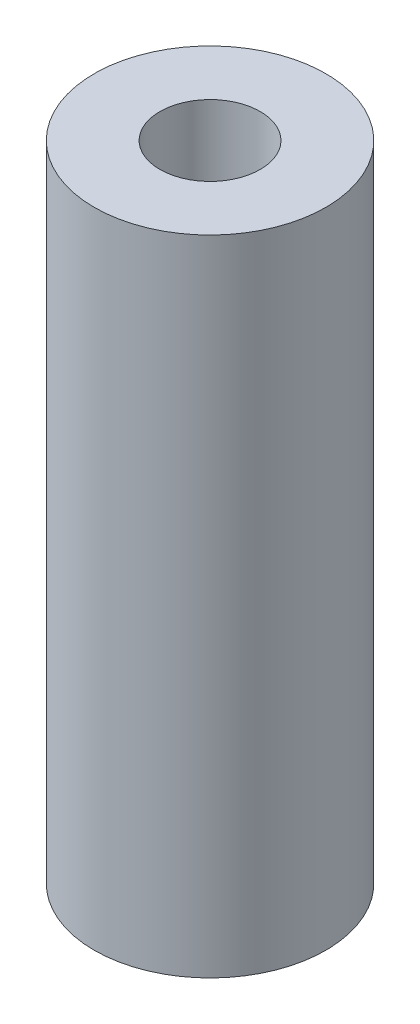
from build123d import *

# Parameters (mm, degrees)
SKETCH1_R           = 4.5
SKETCH1_R_2         = 2.05
BOSS_EXTRUDE1_DEPTH = 10
SKETCH3_R           = 4.5
SKETCH3_R_2         = 1.95
BOSS_EXTRUDE3_DEPTH = 15


with BuildPart() as part:
    # Sketch1 → Boss-Extrude1 (new body)
    with BuildSketch(Plane(origin=(0, 0, 0), x_dir=(1, 0, 0), z_dir=(0, 1, 0))):
        with Locations(Location((0, 0, 0), (0, 0, 270))):
            Circle(SKETCH1_R)
        with Locations(Location((0, 0, 0), (0, 0, 270))):
            Circle(SKETCH1_R_2, mode=Mode.SUBTRACT)
    extrude(amount=BOSS_EXTRUDE1_DEPTH)

    # Sketch3 → Boss-Extrude3 (add)
    with BuildSketch(Plane(origin=(0, 10, 0), x_dir=(1, 0, 0), z_dir=(0, 1, 0))):
        with Locations(Location((0, 0, 0), (0, 0, 270))):
            Circle(SKETCH3_R)
        with Locations(Location((0, 0, 0), (0, 0, 270))):
            Circle(SKETCH3_R_2, mode=Mode.SUBTRACT)
    extrude(amount=BOSS_EXTRUDE3_DEPTH)


solid = part.part
